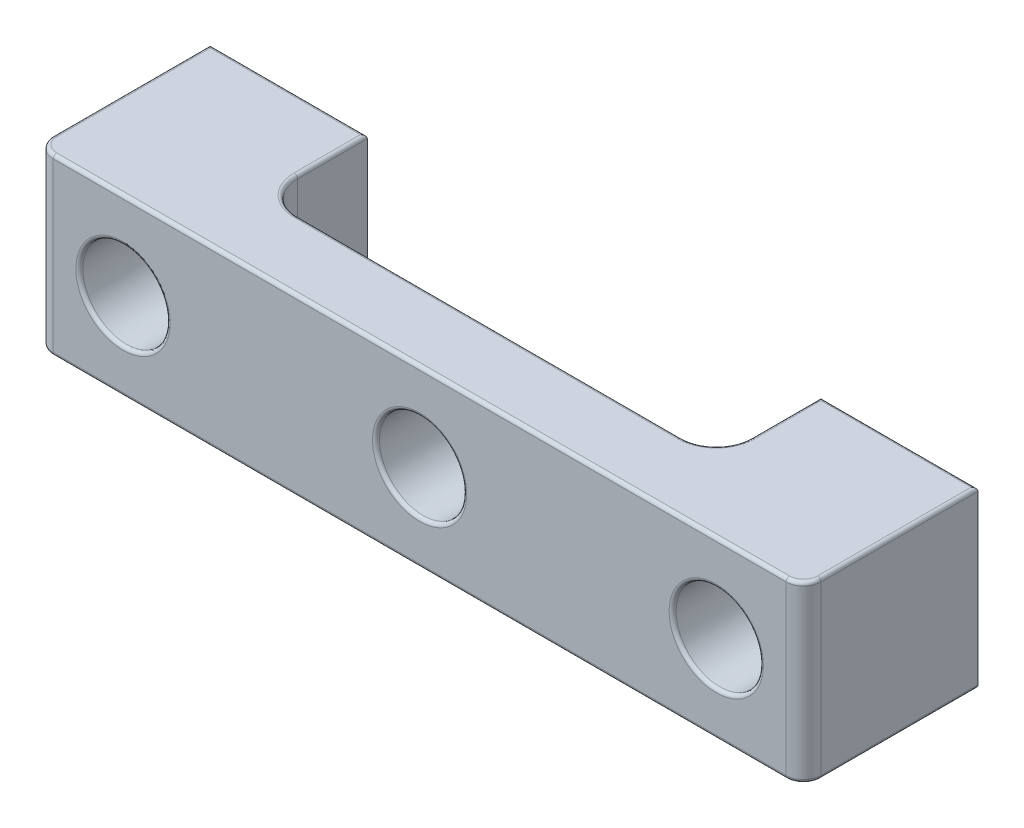
from build123d import *

# Parameters (mm, degrees)
SKETCH1_W           = 22
SKETCH1_H           = 5
SKETCH1_R           = 1.25
BOSS_EXTRUDE1_DEPTH = 5
SKETCH2_W           = 13
SKETCH2_H           = 3
CUT_EXTRUDE1_DEPTH  = 14.076696831
FILLET1_R           = 1
FILLET2_R           = 0.5
FILLET3_R           = 0.1


with BuildPart() as part:
    # Sketch1 → Boss-Extrude1 (new body)
    with BuildSketch(Plane.XY):
        with Locations((0, 2.5)):
            Rectangle(SKETCH1_W, SKETCH1_H)
        with Locations((8.5, 2.5)):
            Circle(SKETCH1_R, mode=Mode.SUBTRACT)
        with Locations((0, 2.5)):
            Circle(SKETCH1_R, mode=Mode.SUBTRACT)
        with Locations((-8.5, 2.5)):
            Circle(SKETCH1_R, mode=Mode.SUBTRACT)
    extrude(amount=BOSS_EXTRUDE1_DEPTH)

    # Sketch2 → Cut-Extrude1 (cut, through all)
    with BuildSketch(Plane(origin=(0, 5, 0), x_dir=(1, 0, 0), z_dir=(0, 1, 0))):
        with Locations((0, -1.5)):
            Rectangle(SKETCH2_W, SKETCH2_H)
    extrude(amount=-CUT_EXTRUDE1_DEPTH, mode=Mode.SUBTRACT)

    # Fillet1
    fillet1_edges = [part.edges().sort_by_distance(p)[0] for p in [
        (6.5, 2.5, 3),
        (-6.5, 2.5, 3),
    ]]
    fillet(fillet1_edges, radius=FILLET1_R)

    # Fillet2
    fillet2_edges = [part.edges().sort_by_distance(p)[0] for p in [
        (-11, 2.5, 5),
        (11, 2.5, 5),
    ]]
    fillet(fillet2_edges, radius=FILLET2_R)

    # Fillet3
    fillet3_edges = [part.edges().sort_by_distance(p)[0] for p in [
        (10.853553391, 0, 4.853553391),
        (11, 0, 2.25),
        (8.75, 0, 0),
        (6.5, 0, 1),
        (6.207106781, 0, 2.707106781),
        (0, 0, 3),
        (-6.207106781, 0, 2.707106781),
        (-6.5, 0, 1),
        (-8.75, 0, 0),
        (-11, 0, 2.25),
        (-10.853553391, 0, 4.853553391),
        (-1.25, 2.5, 5),
        (-9.75, 2.5, 5),
        (0, 0, 5),
        (7.25, 2.5, 5),
        (-8.75, 5, 0),
        (-6.5, 5, 1),
        (-6.207106781, 5, 2.707106781),
        (0, 5, 3),
        (6.207106781, 5, 2.707106781),
        (6.5, 5, 1),
        (8.75, 5, 0),
        (11, 5, 2.25),
        (10.853553391, 5, 4.853553391),
        (0, 5, 5),
        (-10.853553391, 5, 4.853553391),
        (-11, 5, 2.25),
    ]]
    fillet(fillet3_edges, radius=FILLET3_R)


solid = part.part
